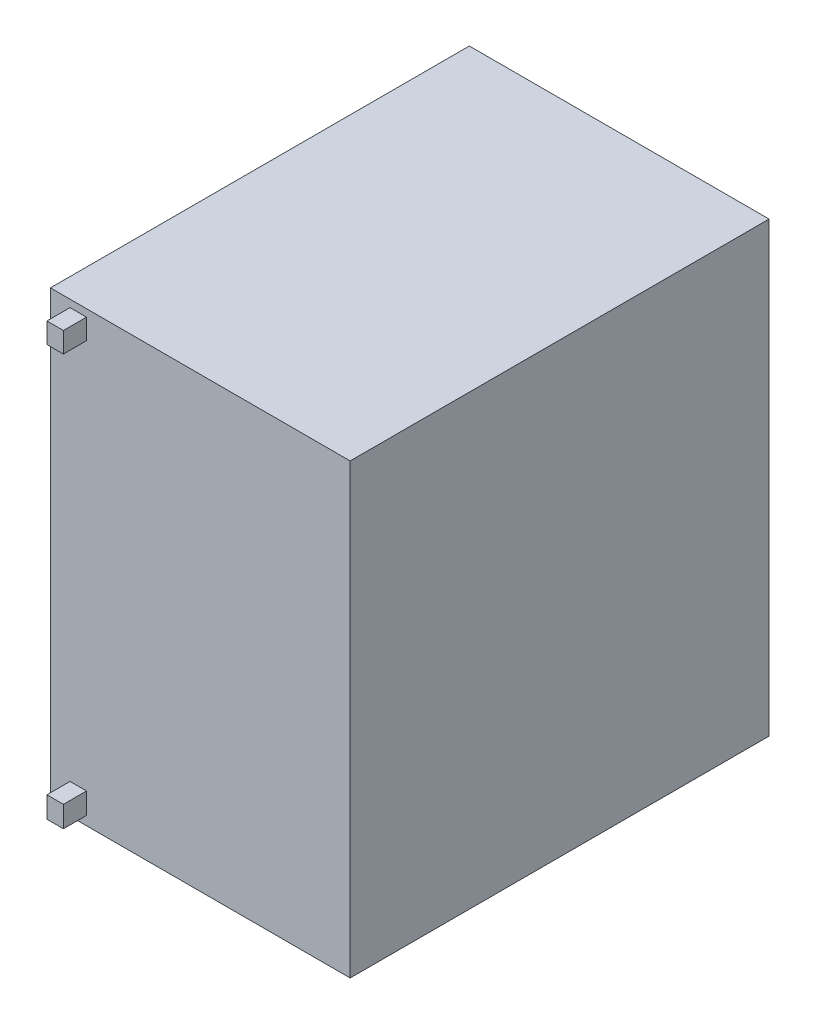
from build123d import *

# Parameters (mm, degrees)
SKETCH1_W           = 131.7625
SKETCH1_H           = 184.15
BOSS_EXTRUDE1_DEPTH = 196.85
SKETCH2_W           = 7.243123939
SKETCH2_H           = 8.967677257
SKETCH2_H_2         = 9.31258792
BOSS_EXTRUDE2_DEPTH = 10.16


with BuildPart() as part:
    # Sketch1 → Boss-Extrude1 (new body)
    with BuildSketch(Plane(origin=(0, 0, 0), x_dir=(1, 0, 0), z_dir=(0, 1, 0))):
        with Locations((-65.88125, -92.075)):
            Rectangle(SKETCH1_W, SKETCH1_H)
    extrude(amount=BOSS_EXTRUDE1_DEPTH)


with BuildPart() as part_1:
    # Body-Move/Copy1: moved
    add(part.part.moved(Location((118.999, -260.35, -108.458))))

    # Sketch2 → Boss-Extrude2 (add)
    with BuildSketch(Plane.XY.offset(75.692)):
        with Locations((-0.518268716, -71.195276502)):
            Rectangle(SKETCH2_W, SKETCH2_H)
        with Locations((-0.518268716, -251.756008966)):
            Rectangle(SKETCH2_W, SKETCH2_H_2)
    extrude(amount=BOSS_EXTRUDE2_DEPTH)


solid = part_1.part
